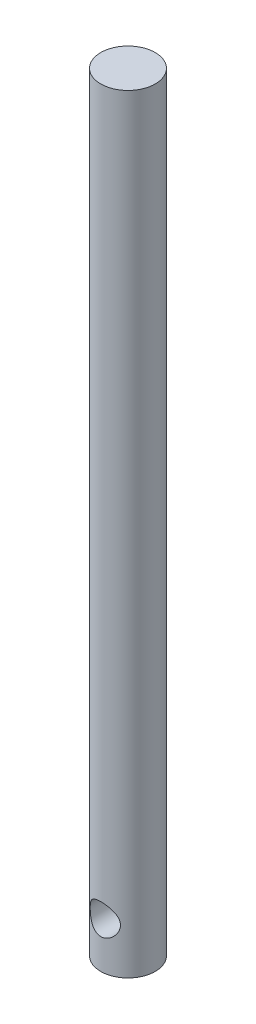
from build123d import *

# Parameters (mm, degrees)
SKETCH5_R           = 9
BOSS_EXTRUDE2_DEPTH = 254
SKETCH7_R           = 5
CUT_EXTRUDE2_DEPTH  = 50


with BuildPart() as part:
    # Sketch5 → Boss-Extrude2 (new body)
    with BuildSketch(Plane(origin=(0, 0, 0), x_dir=(1, 0, 0), z_dir=(0, 1, 0))):
        with Locations(Location((32.666511495, 0, 0), (0, 0, 270))):
            Circle(SKETCH5_R)
    extrude(amount=BOSS_EXTRUDE2_DEPTH)

    # Sketch7 → Cut-Extrude2 (cut)
    with BuildSketch(Plane.XY.offset(9)):
        with Locations(Location((32.666511495, 15, 0), (0, 0, 89.999999967))):
            Circle(SKETCH7_R)
    extrude(amount=-CUT_EXTRUDE2_DEPTH, mode=Mode.SUBTRACT)


solid = part.part
